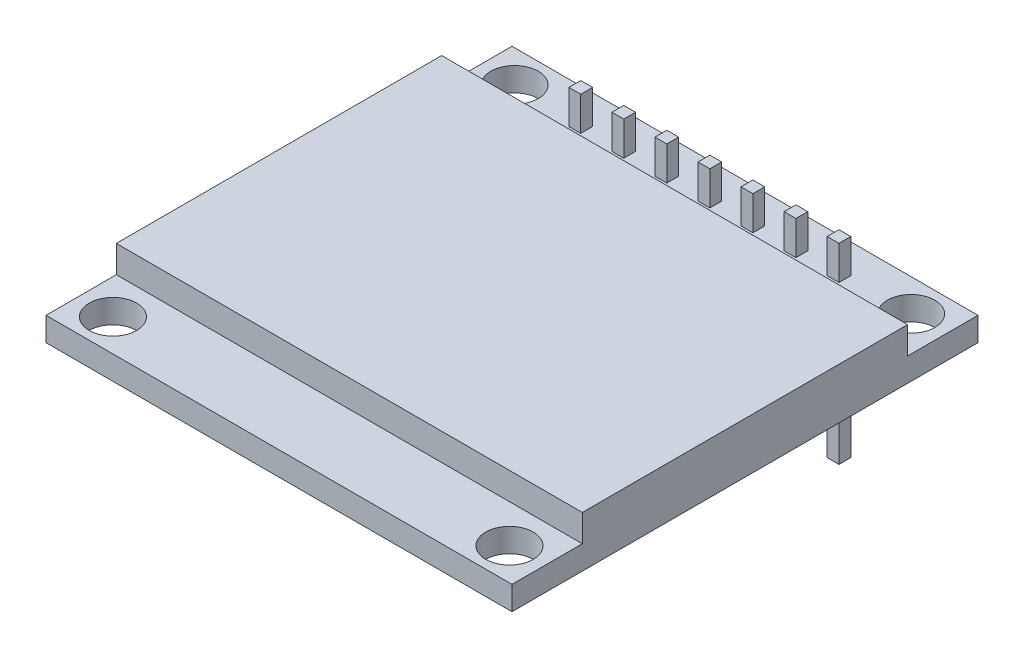
from build123d import *

# Parameters (mm, degrees)
SKETCH_1_W      = 27.5
SKETCH_1_H      = 27.5
SKETCH_1_R      = 1.4
EXTRUDE_1_DEPTH = 1.4
SKETCH_1_3_W    = 27.5
SKETCH_1_3_H    = 19.2
EXTRUDE_2_DEPTH = 3
SKETCH_1_4_W    = 2.54
SKETCH_1_4_H    = 2.54
EXTRUDE_3_DEPTH = 2.54
EXTRUDE_START   = 3.4
SKETCH_1_5_W    = 0.7
SKETCH_1_5_H    = 0.7
EXTRUDE_4_DEPTH = 11.3


with BuildPart() as part:
    # 草图1 → 凸台-拉伸1 (new body)
    with BuildSketch(Plane(origin=(0, 0, 0), x_dir=(1, 0, 0), z_dir=(0, 1, 0))):
        with Locations((13.75, -13.75)):
            Rectangle(SKETCH_1_W, SKETCH_1_H)
        with Locations((2.05, -1.9)):
            Circle(SKETCH_1_R, mode=Mode.SUBTRACT)
        with Locations((25.45, -1.9)):
            Circle(SKETCH_1_R, mode=Mode.SUBTRACT)
        with Locations((2.05, -25.6)):
            Circle(SKETCH_1_R, mode=Mode.SUBTRACT)
        with Locations((25.45, -25.6)):
            Circle(SKETCH_1_R, mode=Mode.SUBTRACT)
    extrude(amount=EXTRUDE_1_DEPTH)

    # 草图1<3> → 凸台-拉伸2 (add)
    with BuildSketch(Plane(origin=(0, 0, 0), x_dir=(1, 0, 0), z_dir=(0, 1, 0))):
        with Locations((13.75, -13.75)):
            Rectangle(SKETCH_1_3_W, SKETCH_1_3_H)
    extrude(amount=EXTRUDE_2_DEPTH)

    # 草图1<4> → 凸台-拉伸3 (add)
    with BuildSketch(Plane(origin=(0, 0, 0), x_dir=(1, 0, 0), z_dir=(0, 1, 0))):
        with Locations((6.13, -2.075)):
            Rectangle(SKETCH_1_4_W, SKETCH_1_4_H)
        with Locations((8.67, -2.075)):
            Rectangle(SKETCH_1_4_W, SKETCH_1_4_H)
        with Locations((11.21, -2.075)):
            Rectangle(SKETCH_1_4_W, SKETCH_1_4_H)
        with Locations((13.75, -2.075)):
            Rectangle(SKETCH_1_4_W, SKETCH_1_4_H)
        with Locations((16.29, -2.075)):
            Rectangle(SKETCH_1_4_W, SKETCH_1_4_H)
        with Locations((18.83, -2.075)):
            Rectangle(SKETCH_1_4_W, SKETCH_1_4_H)
        with Locations((21.37, -2.075)):
            Rectangle(SKETCH_1_4_W, SKETCH_1_4_H)
    extrude(amount=-EXTRUDE_3_DEPTH)

    # 草图1<5> → 凸台-拉伸4 (add)
    with BuildSketch(Plane(origin=(0, 0, 0), x_dir=(1, 0, 0), z_dir=(0, 1, 0)).offset(EXTRUDE_START)):
        with Locations((6.13, -2.075)):
            Rectangle(SKETCH_1_5_W, SKETCH_1_5_H)
        with Locations((8.67, -2.075)):
            Rectangle(SKETCH_1_5_W, SKETCH_1_5_H)
        with Locations((11.21, -2.075)):
            Rectangle(SKETCH_1_5_W, SKETCH_1_5_H)
        with Locations((13.75, -2.075)):
            Rectangle(SKETCH_1_5_W, SKETCH_1_5_H)
        with Locations((16.29, -2.075)):
            Rectangle(SKETCH_1_5_W, SKETCH_1_5_H)
        with Locations((18.83, -2.075)):
            Rectangle(SKETCH_1_5_W, SKETCH_1_5_H)
        with Locations((21.37, -2.075)):
            Rectangle(SKETCH_1_5_W, SKETCH_1_5_H)
    extrude(amount=-EXTRUDE_4_DEPTH)


solid = part.part
